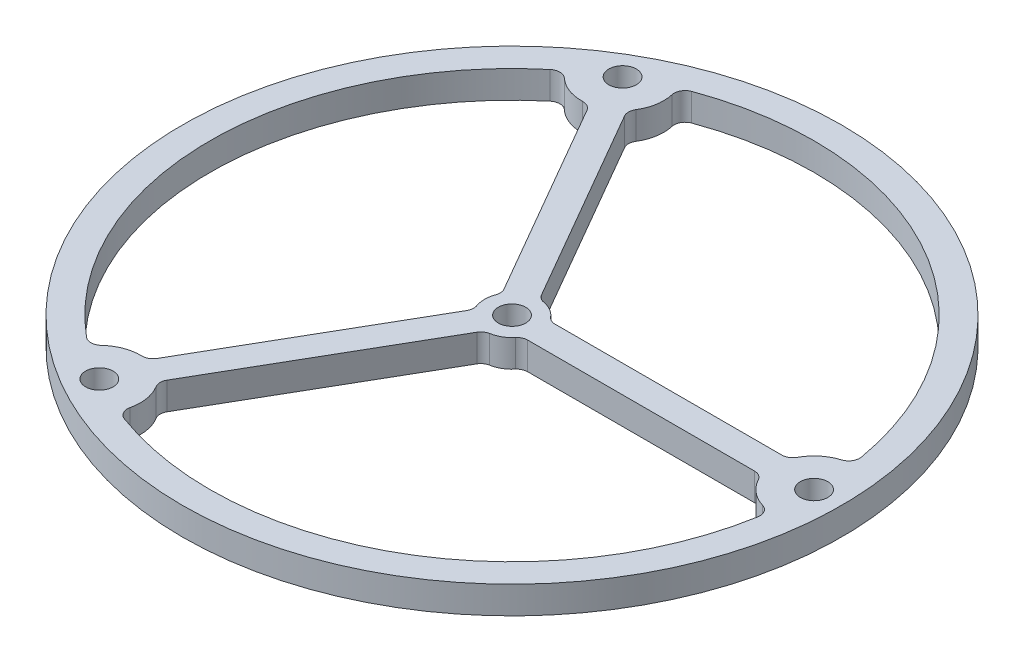
from build123d import *
from build123d.topology import SkipClean

# Parameters (mm, degrees)
SKETCH1_R           = 76.2
SKETCH1_R_2         = 3.175
BOSS_EXTRUDE1_DEPTH = 3.175
SKETCH2_R           = 3.175
CUT_EXTRUDE1_DEPTH  = 108.809835474
CIRPATTERN1_COUNT   = 3
SKETCH3_R           = 3.175
BOSS_EXTRUDE2_DEPTH = 3.175
CIRPATTERN2_COUNT   = 3
FILLET1_R           = 2.54
CUT_EXTRUDE2_DEPTH  = 108.809835619
CIRPATTERN3_COUNT   = 3


with BuildPart() as part:
    # Sketch1 → Boss-Extrude1 (new body)
    with BuildSketch(Plane(origin=(0, 0, 0), x_dir=(1, 0, 0), z_dir=(0, 1, 0))):
        with Locations(Location((0, 0, 0), (0, 0, 270))):
            Circle(SKETCH1_R)
        with Locations(Location((0, 0, 0), (0, 0, 270))):
            Circle(SKETCH1_R_2, mode=Mode.SUBTRACT)
    extrude(amount=BOSS_EXTRUDE1_DEPTH)

    # Sketch2 → Cut-Extrude1 (cut, through all)
    with BuildSketch(Plane(origin=(0, 3.175, 0), x_dir=(1, 0, 0), z_dir=(0, 1, 0))):
        with Locations(Location((69.85, 0, 0), (0, 0, 270))):
            Circle(SKETCH2_R)
    cut_extrude1 = extrude(amount=-CUT_EXTRUDE1_DEPTH, mode=Mode.SUBTRACT)

    # CirPattern1: Cut-Extrude1 ×3 about axis
    cirpattern1_axis = Axis((0, 0, 0), (0, 1, 0))
    for i in range(1, CIRPATTERN1_COUNT):
        add(cut_extrude1.rotate(cirpattern1_axis, i * 360 / CIRPATTERN1_COUNT), mode=Mode.SUBTRACT)

    # Sketch3 → Boss-Extrude2 (add)
    with BuildSketch(Plane(origin=(0, 3.175, 0), x_dir=(1, 0, 0), z_dir=(0, 1, 0))):
        with BuildLine():
            Line((-27.685241282, -54.302244521), (0, -6.35))
            ThreePointArc((0, -6.35), (3.175, 5.499261314), (-5.499261314, -3.175))
            Line((-5.499261314, -3.175), (-33.184502596, -51.127244521))
            ThreePointArc((-33.184502596, -51.127244521), (-38.613147674, -51.709893372), (-42.829980166, -55.178032758))
            ThreePointArc((-42.829980166, -55.178032758), (-62.732354549, -30.719280472), (-69.85, 0))
            Line((-69.85, 0), (-76.2, 0))
            ThreePointArc((-76.2, 0), (-38.1, -65.991135768), (38.1, -65.991135768))
            Line((38.1, -65.991135768), (34.925, -60.491874454))
            ThreePointArc((34.925, -60.491874454), (4.7625, -69.687452915), (-26.370588016, -64.680867246))
            ThreePointArc((-26.370588016, -64.680867246), (-25.47550745, -59.294913492), (-27.685241282, -54.302244521))
        make_face()
        with Locations((-34.925, -60.491874454)):
            Circle(SKETCH3_R, mode=Mode.SUBTRACT)
        Circle(SKETCH3_R, mode=Mode.SUBTRACT)
    boss_extrude2 = extrude(amount=BOSS_EXTRUDE2_DEPTH)

    # CirPattern2: Boss-Extrude2 ×3 about axis
    with SkipClean():  # the faces are left unmerged after this step: merging them gives an invalid solid
        cirpattern2_axis = Axis((0, 0, 0), (0, 1, 0))
        for i in range(1, CIRPATTERN2_COUNT):
            add(boss_extrude2.rotate(cirpattern2_axis, i * 360 / CIRPATTERN2_COUNT))

    # Fillet1
    fillet1_edges = [part.edges().sort_by_distance(p)[0] for p in [
        (0, 4.7625, 6.35),
        (-5.499261314, 4.7625, 3.175),
        (-33.184502596, 4.7625, 51.127244521),
        (-42.829980166, 4.7625, 55.178032758),
        (-26.370588016, 4.7625, 64.680867246),
        (-27.685241282, 4.7625, 54.302244521),
        (-5.499261314, 4.7625, -3.175),
        (5.499261314, 4.7625, -3.175),
        (5.499261314, 4.7625, 3.175),
        (60.869743879, 4.7625, 3.175),
        (69.200568182, 4.7625, 9.502834488),
        (-26.370588016, 4.7625, -64.680867246),
        (69.200568182, 4.7625, -9.502834488),
        (60.869743879, 4.7625, -3.175),
        (0, 4.7625, -6.35),
        (-27.685241282, 4.7625, -54.302244521),
        (-42.829980166, 4.7625, -55.178032758),
        (-33.184502596, 4.7625, -51.127244521),
    ]]
    fillet(fillet1_edges, radius=FILLET1_R)

    # Sketch4 → Cut-Extrude2 (cut, through all)
    with SkipClean():  # the faces are left unmerged after this step: merging them gives an invalid solid
        with BuildSketch(Plane(origin=(0, 3.175, 0), x_dir=(1, 0, 0), z_dir=(0, 1, 0))):
            with BuildLine():
                Line((-6.154438838, 4.30980076), (-32.361839489, 49.702350221))
                ThreePointArc((-32.361839489, 49.702350221), (-33.324824736, 50.650936578), (-34.638061064, 50.971197428))
                ThreePointArc((-34.638061064, 50.971197428), (-38.278807741, 51.576853499), (-41.416002253, 53.521041308))
                ThreePointArc((-41.416002253, 53.521041308), (-43.078433965, 54.20122857), (-44.775122458, 53.611667656))
                ThreePointArc((-44.775122458, 53.611667656), (-69.85, 0), (-44.775122458, -53.611667656))
                ThreePointArc((-44.775122458, -53.611667656), (-43.078433965, -54.20122857), (-41.416002253, -53.521041308))
                ThreePointArc((-41.416002253, -53.521041308), (-38.278807741, -51.576853499), (-34.638061064, -50.971197428))
                ThreePointArc((-34.638061064, -50.971197428), (-33.324824736, -50.650936578), (-32.361839489, -49.702350221))
                Line((-32.361839489, -49.702350221), (-6.154438838, -4.30980076))
                ThreePointArc((-6.154438838, -4.30980076), (-5.823818881, -3.261291188), (-5.96724526, -2.171286257))
                ThreePointArc((-5.96724526, -2.171286257), (-6.35, 0), (-5.96724526, 2.171286257))
                ThreePointArc((-5.96724526, 2.171286257), (-5.823818881, 3.261291188), (-6.154438838, 4.30980076))
            make_face()
        cut_extrude2 = extrude(amount=-CUT_EXTRUDE2_DEPTH, mode=Mode.SUBTRACT)

    # CirPattern3: Cut-Extrude2 ×3 about axis
    with SkipClean():  # the faces are left unmerged after this step: merging them gives an invalid solid
        cirpattern3_axis = Axis((0, 3.175, 0), (0, -1, 0))
        for i in range(1, CIRPATTERN3_COUNT):
            add(cut_extrude2.rotate(cirpattern3_axis, i * 360 / CIRPATTERN3_COUNT), mode=Mode.SUBTRACT)


solid = part.part
